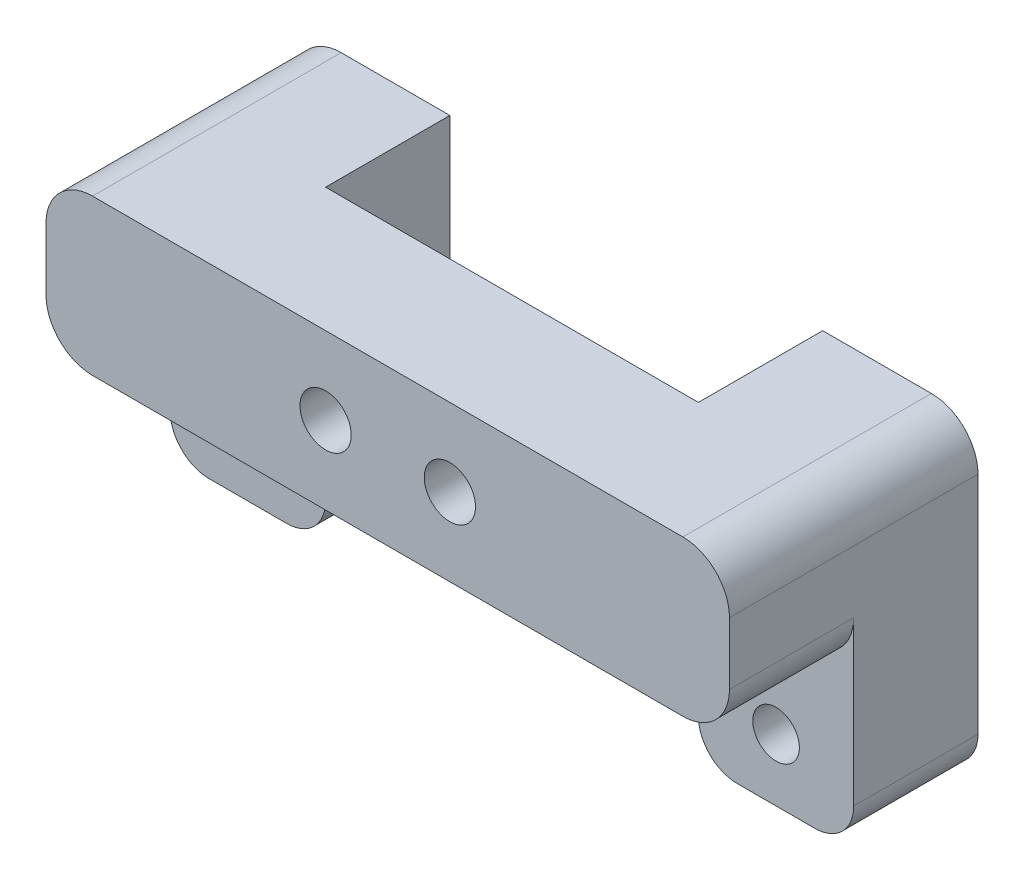
from build123d import *

# Parameters (mm, degrees)
SKETCH1_W           = 44
SKETCH1_H           = 10
BOSS_EXTRUDE1_DEPTH = 8
SKETCH4_W           = 10
SKETCH4_H           = 10
BOSS_EXTRUDE2_DEPTH = 8
SKETCH3_R           = 1.65
CUT_EXTRUDE2_DEPTH  = 48.874836814
SKETCH5_W           = 10
SKETCH5_H           = 8
BOSS_EXTRUDE3_DEPTH = 10
SKETCH6_R           = 1.5
CUT_EXTRUDE3_DEPTH  = 49.989794856
FILLET2_R           = 2.5
FILLET1_R           = 3


with BuildPart() as part:
    # Sketch1 → Boss-Extrude1 (new body)
    with BuildSketch(Plane.XY):
        with Locations((22, -5)):
            Rectangle(SKETCH1_W, SKETCH1_H)
    extrude(amount=BOSS_EXTRUDE1_DEPTH)

    # Sketch4 → Boss-Extrude2 (add)
    with BuildSketch(Plane(origin=(0, 0, 0), x_dir=(-1, 0, 0), z_dir=(0, 0, -1))):
        with Locations((-5, -5)):
            Rectangle(SKETCH4_W, SKETCH4_H)
        with Locations((-39, -5)):
            Rectangle(SKETCH4_W, SKETCH4_H)
    extrude(amount=BOSS_EXTRUDE2_DEPTH)

    # Sketch3 → Cut-Extrude2 (cut, through all)
    with BuildSketch(Plane.XY.offset(8)):
        with Locations((18, -5)):
            Circle(SKETCH3_R)
        with Locations((26, -5)):
            Circle(SKETCH3_R)
    extrude(amount=-CUT_EXTRUDE2_DEPTH, mode=Mode.SUBTRACT)

    # Sketch5 → Boss-Extrude3 (add)
    with BuildSketch(Plane(origin=(0, -10, 0), x_dir=(-1, 0, 0), z_dir=(0, -1, 0))):
        with Locations((-5, 4)):
            Rectangle(SKETCH5_W, SKETCH5_H)
        with Locations((-39, 4)):
            Rectangle(SKETCH5_W, SKETCH5_H)
    extrude(amount=BOSS_EXTRUDE3_DEPTH)

    # Sketch6 → Cut-Extrude3 (cut, through all)
    with BuildSketch(Plane.XY):
        with Locations((5, -16)):
            Circle(SKETCH6_R)
        with Locations((39, -16)):
            Circle(SKETCH6_R)
    extrude(amount=-CUT_EXTRUDE3_DEPTH, mode=Mode.SUBTRACT)

    # Fillet2
    fillet2_edges = [part.edges().sort_by_distance(p)[0] for p in [
        (10, -20, -4),
        (0, -20, -4),
        (34, -20, -4),
        (44, -20, -4),
    ]]
    fillet(fillet2_edges, radius=FILLET2_R)

    # Fillet1
    fillet1_edges = [part.edges().sort_by_distance(p)[0] for p in [
        (0, 0, 0),
        (44, 0, 0),
        (44, -10, 4),
        (0, -10, 4),
    ]]
    fillet(fillet1_edges, radius=FILLET1_R)


solid = part.part
